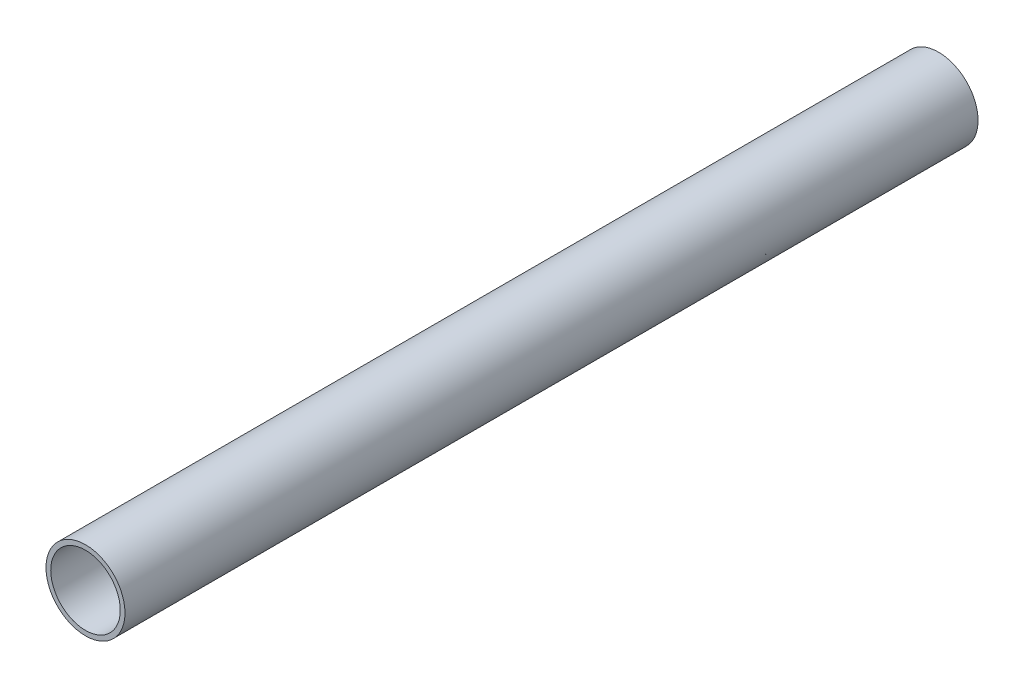
from build123d import *

# Parameters (mm, degrees)
SKETCH_1_R          = 12.5
EXTRUDE_2_DEPTH     = 235.43
SKETCH_2_R          = 9
CUT_EXTRUDE_1_DEPTH = 235.43
EXTRUDE_START       = 15.57
SKETCH_3_R          = 12.5
EXTRUDE_3_DEPTH     = 15.57
SKETCH_4_R          = 9
CUT_EXTRUDE_2_DEPTH = 20
EXTRUDE_START_2     = 9.93
SKETCH_5_R          = 12.5
EXTRUDE_4_DEPTH     = 9.93
SKETCH_6_R          = 9
CUT_EXTRUDE_3_DEPTH = 10
SKETCH_7_R          = 26.85848727
CUT_EXTRUDE_4_DEPTH = 14.93
SKETCH_8_R          = 12.5
EXTRUDE_5_DEPTH     = 9.93
SKETCH_9_R          = 9
CUT_EXTRUDE_5_DEPTH = 10
SKETCH_10_R         = 37.193394561
CUT_EXTRUDE_6_DEPTH = 0.22
SKETCH_11_R         = 43.187188263
CUT_EXTRUDE_7_DEPTH = 0.71
SKETCH_12_R         = 12.5
EXTRUDE_6_DEPTH     = 15
CUT_EXTRUDE_START   = -15
SKETCH_13_R         = 9
CUT_EXTRUDE_8_DEPTH = 15
SKETCH_14_R         = 11
CUT_EXTRUDE_9_DEPTH = 320


with BuildPart() as part:
    # 草图1 → 凸台-拉伸2 (new body)
    with BuildSketch(Plane.XY):
        Circle(SKETCH_1_R)
    extrude(amount=EXTRUDE_2_DEPTH)

    # 草图2 → 切除-拉伸1 (cut)
    with BuildSketch(Plane(origin=(0, 0, 0), x_dir=(-1, 0, 0), z_dir=(0, 0, -1))):
        Circle(SKETCH_2_R)
    extrude(amount=-CUT_EXTRUDE_1_DEPTH, mode=Mode.SUBTRACT)

    # 草图3 → 凸台-拉伸3 (add)
    with BuildSketch(Plane(origin=(0, 0, 0), x_dir=(-1, 0, 0), z_dir=(0, 0, -1)).offset(EXTRUDE_START)):
        Circle(SKETCH_3_R)
    extrude(amount=-EXTRUDE_3_DEPTH)

    # 草图4 → 切除-拉伸2 (cut)
    with BuildSketch(Plane(origin=(0, 0, -15.57), x_dir=(-1, 0, 0), z_dir=(0, 0, -1))):
        Circle(SKETCH_4_R)
    extrude(amount=-CUT_EXTRUDE_2_DEPTH, mode=Mode.SUBTRACT)

    # 草图5 → 凸台-拉伸4 (add)
    with BuildSketch(Plane(origin=(0, 0, -15.57), x_dir=(-1, 0, 0), z_dir=(0, 0, -1)).offset(EXTRUDE_START_2)):
        Circle(SKETCH_5_R)
    extrude(amount=-EXTRUDE_4_DEPTH)

    # 草图6 → 切除-拉伸3 (cut)
    with BuildSketch(Plane(origin=(0, 0, -25.5), x_dir=(-1, 0, 0), z_dir=(0, 0, -1))):
        Circle(SKETCH_6_R)
    extrude(amount=-CUT_EXTRUDE_3_DEPTH, mode=Mode.SUBTRACT)

    # 草图7 → 切除-拉伸4 (cut)
    with BuildSketch(Plane(origin=(0, 0, -25.5), x_dir=(-1, 0, 0), z_dir=(0, 0, -1))):
        Circle(SKETCH_7_R)
    extrude(amount=-CUT_EXTRUDE_4_DEPTH, mode=Mode.SUBTRACT)

    # 草图8 → 凸台-拉伸5 (add)
    with BuildSketch(Plane(origin=(0, 0, -10.57), x_dir=(-1, 0, 0), z_dir=(0, 0, -1)).offset(EXTRUDE_START_2)):
        Circle(SKETCH_8_R)
    extrude(amount=-EXTRUDE_5_DEPTH)

    # 草图9 → 切除-拉伸5 (cut)
    with BuildSketch(Plane(origin=(0, 0, -20.5), x_dir=(-1, 0, 0), z_dir=(0, 0, -1))):
        Circle(SKETCH_9_R)
    extrude(amount=-CUT_EXTRUDE_5_DEPTH, mode=Mode.SUBTRACT)

    # 草图10 → 切除-拉伸6 (cut)
    with BuildSketch(Plane(origin=(0, 0, -20.5), x_dir=(-1, 0, 0), z_dir=(0, 0, -1))):
        with Locations((7.201744855, 7.507888779)):
            Circle(SKETCH_10_R)
    extrude(amount=-CUT_EXTRUDE_6_DEPTH, mode=Mode.SUBTRACT)

    # 草图11 → 切除-拉伸7 (cut)
    with BuildSketch(Plane(origin=(0, 0, -20.28), x_dir=(-1, 0, 0), z_dir=(0, 0, -1))):
        with Locations((-1.225460352, 2.329416421)):
            Circle(SKETCH_11_R)
    extrude(amount=-CUT_EXTRUDE_7_DEPTH, mode=Mode.SUBTRACT)

    # 草图12 → 凸台-拉伸6 (add)
    with BuildSketch(Plane.XY.offset(235.43)):
        with Locations(Location((0, 0, 0), (0, 0, 180))):
            Circle(SKETCH_12_R)
    extrude(amount=EXTRUDE_6_DEPTH)

    # 草图13 → 切除-拉伸8 (cut)
    with BuildSketch(Plane.XY.offset(250.43).offset(CUT_EXTRUDE_START)):
        with Locations(Location((0, 0, 0), (0, 0, 180))):
            Circle(SKETCH_13_R)
    extrude(amount=CUT_EXTRUDE_8_DEPTH, mode=Mode.SUBTRACT)

    # 草图14 → 切除-拉伸9 (cut)
    with BuildSketch(Plane(origin=(0, 0, -19.57), x_dir=(-1, 0, 0), z_dir=(0, 0, -1))):
        Circle(SKETCH_14_R)
    extrude(amount=-CUT_EXTRUDE_9_DEPTH, mode=Mode.SUBTRACT)


solid = part.part
